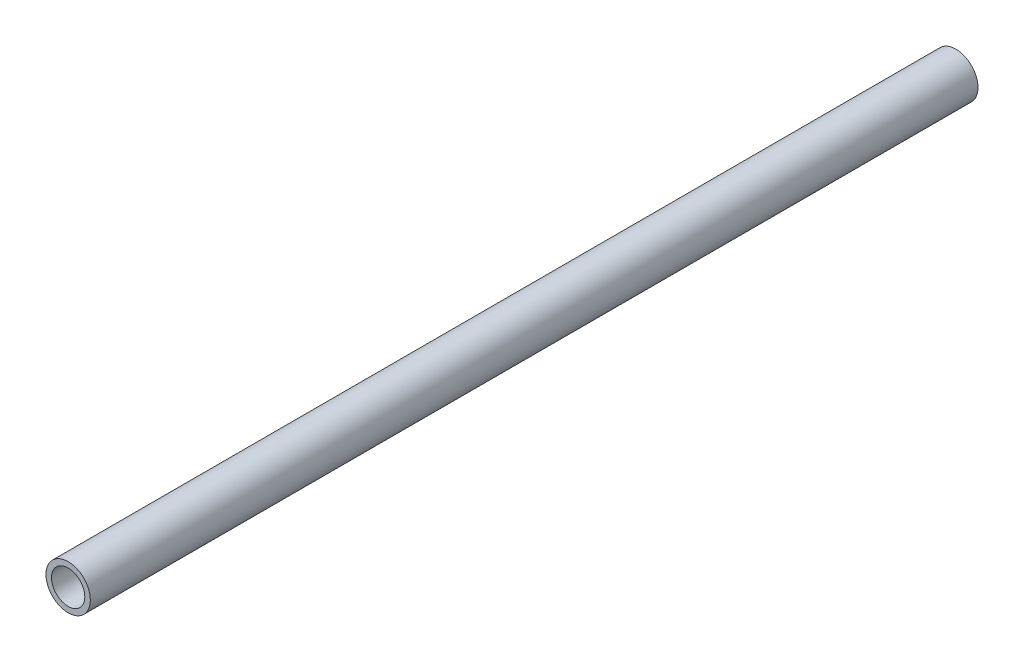
from build123d import *

# Parameters (mm, degrees)
SKETCH1_R           = 1
BOSS_EXTRUDE1_DEPTH = 40
SKETCH2_R           = 0.75
CUT_EXTRUDE1_DEPTH  = 40


with BuildPart() as part:
    # Sketch1 → Boss-Extrude1 (new body)
    with BuildSketch(Plane.XY):
        Circle(SKETCH1_R)
    extrude(amount=BOSS_EXTRUDE1_DEPTH)

    # Sketch2 → Cut-Extrude1 (cut)
    with BuildSketch(Plane.XY.offset(40)):
        Circle(SKETCH2_R)
    extrude(amount=-CUT_EXTRUDE1_DEPTH, mode=Mode.SUBTRACT)


solid = part.part
